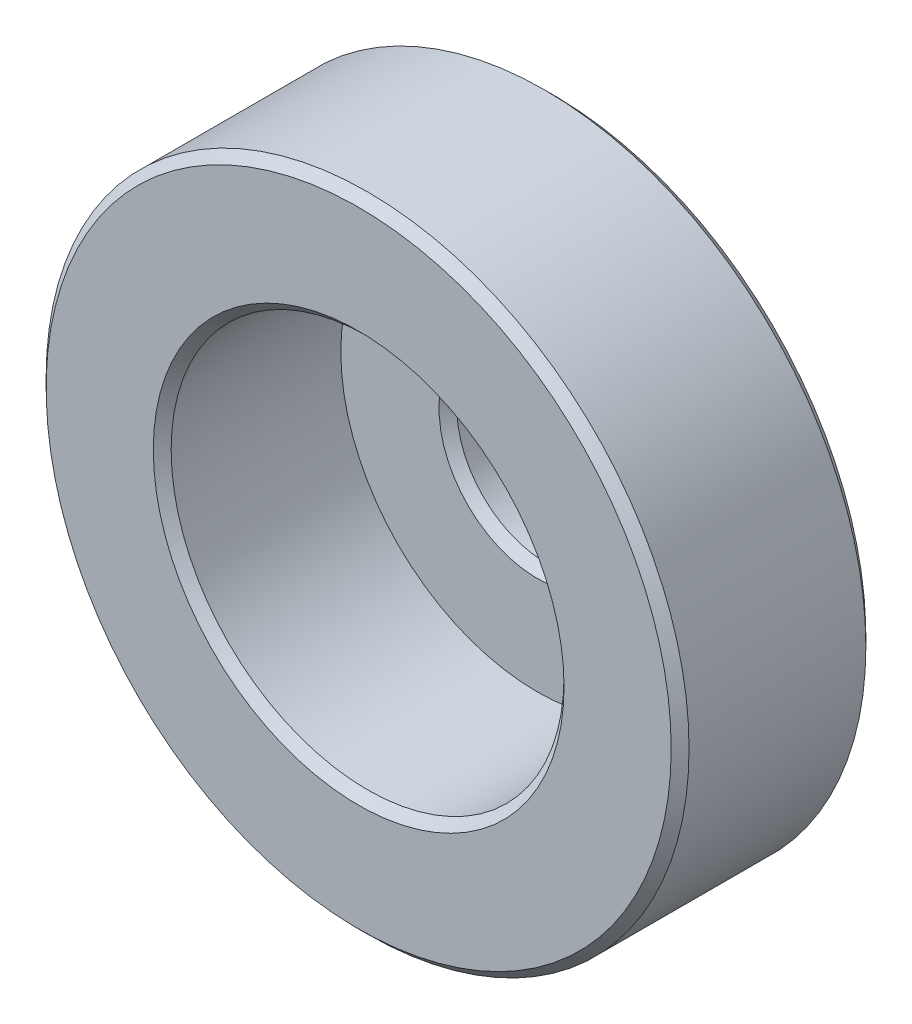
from build123d import *

# Parameters (mm, degrees)
CUT_EXTRUDE1_START = -1.5
CUT_EXTRUDE1_DEPTH = 1.5
CHAMFER1_SIZE      = 0.5


with BuildPart() as part:
    # Sketch2 → Revolve1 (revolve)
    with BuildSketch(Plane(origin=(0, 0, 0), x_dir=(1, 0, 0), z_dir=(0, 1, 0))):
        Polygon((-18, -4.5), (-11, -4.5), (-11, 0), (-5, 0), (-5, -5.4), (-11, -5.4), (-11, -15.4), (-18, -15.4), align=None)
    revolve(axis=Axis((0, 0, 0), (0, 0, 1)))

    # Sketch3 → Cut-Extrude1 (cut)
    with BuildSketch(Plane(origin=(0, 0, 0), x_dir=(-1, 0, 0), z_dir=(0, 0, -1)).offset(CUT_EXTRUDE1_START)):
        with BuildLine():
            Line((1.25, 10.940968966), (1.25, 4.841229183))
            ThreePointArc((1.25, 4.841229183), (0, 5), (-1.25, 4.841229183))
            Line((-1.25, 4.841229183), (-1.25, 10.940968966))
            ThreePointArc((-1.25, 10.940968966), (0, 11.012143385), (1.25, 10.940968966))
        make_face()
        with BuildLine():
            Line((1.25, -4.841229183), (1.25, -10.940968966))
            ThreePointArc((1.25, -10.940968966), (0, -11.012143385), (-1.25, -10.940968966))
            Line((-1.25, -10.940968966), (-1.25, -4.841229183))
            ThreePointArc((-1.25, -4.841229183), (0, -5), (1.25, -4.841229183))
        make_face()
    extrude(amount=CUT_EXTRUDE1_DEPTH, mode=Mode.SUBTRACT)

    # Chamfer1
    chamfer1_edges = [part.edges().sort_by_distance(p)[0] for p in [
        (11, 0, 0),
        (-8.20822758, 7.322909258, 0),
        (18, 0, 15.4),
        (18, 0, 4.5),
        (5, 0, 5.4),
        (11, 0, 15.4),
    ]]
    chamfer(chamfer1_edges, length=CHAMFER1_SIZE)


solid = part.part
